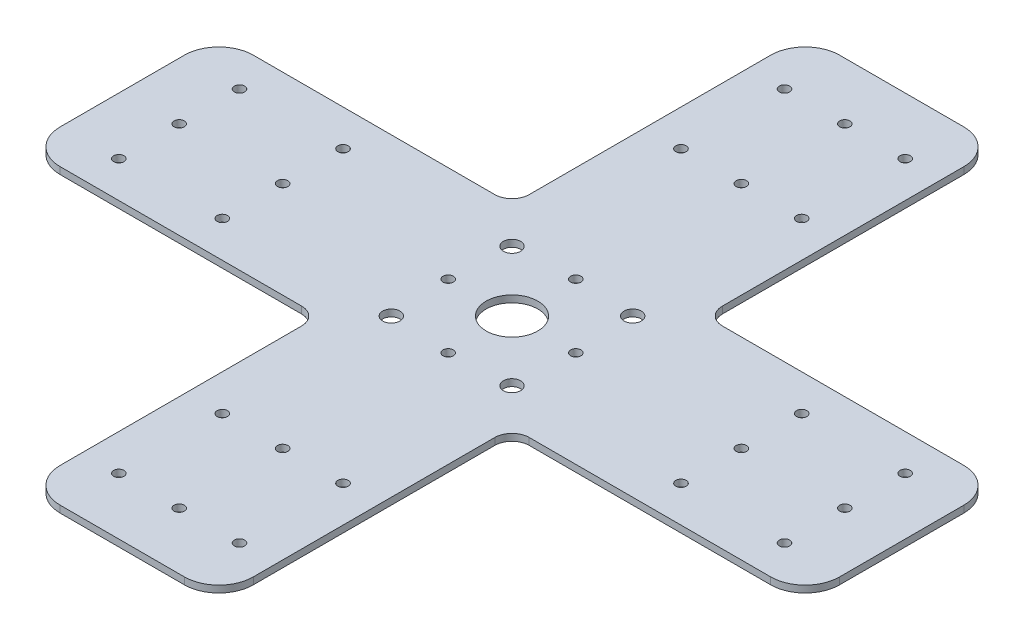
from build123d import *

# Parameters (mm, degrees)
SKETCH1_W           = 56
SKETCH1_H           = 56
BOSS_EXTRUDE2_DEPTH = 2
SKETCH2_R           = 7.5
SKETCH2_R_2         = 1.5
CUT_EXTRUDE1_DEPTH  = 160.818647222
SKETCH3_R           = 2.5
SKETCH3_R_2         = 1.5
CUT_EXTRUDE2_DEPTH  = 160.818647222


with BuildPart() as part:
    # Sketch1 → Boss-Extrude2 (new body)
    with BuildSketch(Plane(origin=(0, 0, 0), x_dir=(1, 0, 0), z_dir=(0, 1, 0))):
        with BuildLine():
            Line((28, 33), (28, 103))
            ThreePointArc((28, 103), (25.071067812, 110.071067812), (18, 113))
            Line((18, 113), (-18, 113))
            ThreePointArc((-18, 113), (-25.071067812, 110.071067812), (-28, 103))
            Line((-28, 103), (-28, 33))
            Line((-28, 33), (-28, 28))
            Line((-28, 28), (28, 28))
            Line((28, 28), (28, 33))
        make_face()
        Rectangle(SKETCH1_W, SKETCH1_H)
        with BuildLine():
            Line((-28, -28), (-28, 28))
            Line((-28, 28), (-33, 28))
            Line((-33, 28), (-103, 28))
            ThreePointArc((-103, 28), (-110.071067812, 25.071067812), (-113, 18))
            Line((-113, 18), (-113, -18))
            ThreePointArc((-113, -18), (-110.071067812, -25.071067812), (-103, -28))
            Line((-103, -28), (-33, -28))
            Line((-33, -28), (-28, -28))
        make_face()
        with BuildLine():
            Line((28, -33), (28, -28))
            Line((28, -28), (-28, -28))
            Line((-28, -28), (-28, -33))
            Line((-28, -33), (-28, -103))
            ThreePointArc((-28, -103), (-25.071067812, -110.071067812), (-18, -113))
            Line((-18, -113), (18, -113))
            ThreePointArc((18, -113), (25.071067812, -110.071067812), (28, -103))
            Line((28, -103), (28, -33))
        make_face()
        with BuildLine():
            Line((33, 28), (28, 28))
            Line((28, 28), (28, -28))
            Line((28, -28), (33, -28))
            Line((33, -28), (103, -28))
            ThreePointArc((103, -28), (110.071067812, -25.071067812), (113, -18))
            Line((113, -18), (113, 18))
            ThreePointArc((113, 18), (110.071067812, 25.071067812), (103, 28))
            Line((103, 28), (33, 28))
        make_face()
        with BuildLine():
            Line((33, -28), (28, -28))
            Line((28, -28), (28, -33))
            ThreePointArc((28, -33), (29.464466094, -29.464466094), (33, -28))
        make_face()
        with BuildLine():
            Line((-28, -33), (-28, -28))
            Line((-28, -28), (-33, -28))
            ThreePointArc((-33, -28), (-29.464466094, -29.464466094), (-28, -33))
        make_face()
        with BuildLine():
            Line((-33, 28), (-28, 28))
            Line((-28, 28), (-28, 33))
            ThreePointArc((-28, 33), (-29.464466094, 29.464466094), (-33, 28))
        make_face()
        with BuildLine():
            ThreePointArc((33, 28), (29.464466094, 29.464466094), (28, 33))
            Line((28, 33), (28, 28))
            Line((28, 28), (33, 28))
        make_face()
    extrude(amount=BOSS_EXTRUDE2_DEPTH)

    # Sketch2 → Cut-Extrude1 (cut, through all)
    with BuildSketch(Plane(origin=(0, 2, 0), x_dir=(1, 0, 0), z_dir=(0, 1, 0))):
        with Locations(Location((0, 0, 0), (0, 0, 270))):
            Circle(SKETCH2_R)
        with Locations(Location((-96.5, 0, 0), (0, 0, 270))):
            Circle(SKETCH2_R_2)
        with Locations(Location((-66.5, 0, 0), (0, 0, 270))):
            Circle(SKETCH2_R_2)
        with Locations(Location((-96.5, 17.5, 0), (0, 0, 270))):
            Circle(SKETCH2_R_2)
        with Locations(Location((-66.5, 17.5, 0), (0, 0, 270))):
            Circle(SKETCH2_R_2)
        with Locations(Location((-66.5, -17.5, 0), (0, 0, 90))):
            Circle(SKETCH2_R_2)
        with Locations(Location((-96.5, -17.5, 0), (0, 0, 90))):
            Circle(SKETCH2_R_2)
        with Locations(Location((0, 96.5, 0), (0, 0, 270))):
            Circle(SKETCH2_R_2)
        with Locations(Location((0, 66.5, 0), (0, 0, 270))):
            Circle(SKETCH2_R_2)
        with Locations(Location((17.5, 96.5, 0), (0, 0, 270))):
            Circle(SKETCH2_R_2)
        with Locations(Location((17.5, 66.5, 0), (0, 0, 270))):
            Circle(SKETCH2_R_2)
        with Locations(Location((-17.5, 66.5, 0), (0, 0, 90))):
            Circle(SKETCH2_R_2)
        with Locations(Location((-17.5, 96.5, 0), (0, 0, 90))):
            Circle(SKETCH2_R_2)
        with Locations(Location((96.5, 0, 0), (0, 0, 270))):
            Circle(SKETCH2_R_2)
        with Locations(Location((66.5, 0, 0), (0, 0, 270))):
            Circle(SKETCH2_R_2)
        with Locations(Location((96.5, -17.5, 0), (0, 0, 270))):
            Circle(SKETCH2_R_2)
        with Locations(Location((66.5, -17.5, 0), (0, 0, 270))):
            Circle(SKETCH2_R_2)
        with Locations(Location((66.5, 17.5, 0), (0, 0, 90))):
            Circle(SKETCH2_R_2)
        with Locations(Location((96.5, 17.5, 0), (0, 0, 90))):
            Circle(SKETCH2_R_2)
        with Locations(Location((0, -96.5, 0), (0, 0, 270))):
            Circle(SKETCH2_R_2)
        with Locations(Location((0, -66.5, 0), (0, 0, 270))):
            Circle(SKETCH2_R_2)
        with Locations(Location((-17.5, -96.5, 0), (0, 0, 270))):
            Circle(SKETCH2_R_2)
        with Locations(Location((-17.5, -66.5, 0), (0, 0, 270))):
            Circle(SKETCH2_R_2)
        with Locations(Location((17.5, -66.5, 0), (0, 0, 90))):
            Circle(SKETCH2_R_2)
        with Locations(Location((17.5, -96.5, 0), (0, 0, 90))):
            Circle(SKETCH2_R_2)
    extrude(amount=-CUT_EXTRUDE1_DEPTH, mode=Mode.SUBTRACT)

    # Sketch3 → Cut-Extrude2 (cut, through all)
    with BuildSketch(Plane(origin=(0, 2, 0), x_dir=(1, 0, 0), z_dir=(0, 1, 0))):
        with Locations(Location((-17.5, 17.5, 0), (0, 0, 270))):
            Circle(SKETCH3_R)
        with Locations(Location((17.5, 17.5, 0), (0, 0, 270))):
            Circle(SKETCH3_R)
        with Locations(Location((17.5, -17.5, 0), (0, 0, 270))):
            Circle(SKETCH3_R)
        with Locations(Location((-17.5, -17.5, 0), (0, 0, 270))):
            Circle(SKETCH3_R)
        with Locations(Location((-18.5, 0, 0), (0, 0, 270))):
            Circle(SKETCH3_R_2)
        with Locations(Location((18.5, 0, 0), (0, 0, 270))):
            Circle(SKETCH3_R_2)
        with Locations(Location((0, -18.5, 0), (0, 0, 270))):
            Circle(SKETCH3_R_2)
        with Locations(Location((0, 18.5, 0), (0, 0, 270))):
            Circle(SKETCH3_R_2)
    extrude(amount=-CUT_EXTRUDE2_DEPTH, mode=Mode.SUBTRACT)


solid = part.part
